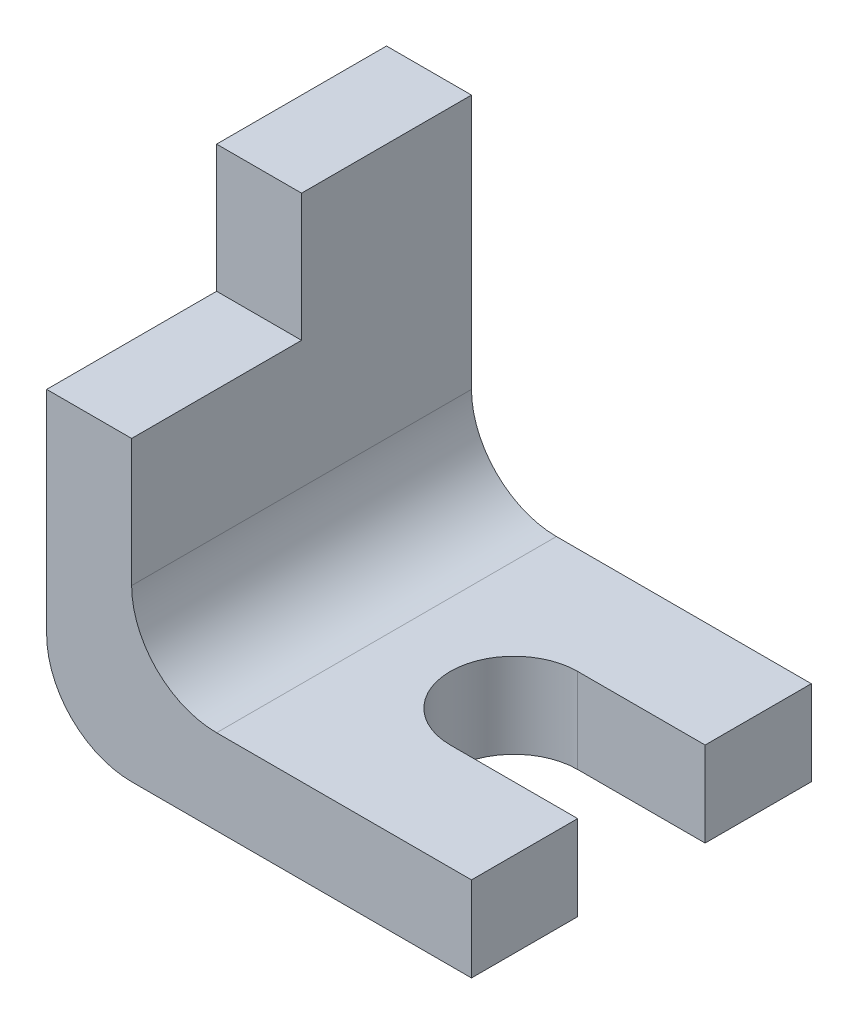
from build123d import *

# Parameters (mm, degrees)
BOSS_EXTRUDE2_DEPTH = 40
SKETCH4_W           = 20
SKETCH4_H           = 15
CUT_EXTRUDE1_DEPTH  = 10
SKETCH5_R           = 7.5
CUT_EXTRUDE2_DEPTH  = 13


with BuildPart() as part:
    # Sketch2 → Boss-Extrude2 (new body)
    with BuildSketch(Plane.XY):
        with BuildLine():
            Line((0, 10), (0, 50))
            Line((0, 50), (10, 50))
            Line((10, 50), (10, 20))
            ThreePointArc((10, 20), (12.928932188, 12.928932188), (20, 10))
            Line((20, 10), (50, 10))
            Line((50, 10), (50, 0))
            Line((50, 0), (10, 0))
            ThreePointArc((10, 0), (2.928932188, 2.928932188), (0, 10))
        make_face()
    extrude(amount=BOSS_EXTRUDE2_DEPTH)

    # Sketch4 → Cut-Extrude1 (cut)
    with BuildSketch(Plane(origin=(0, 0, 0), x_dir=(0, 0, -1), z_dir=(1, 0, 0))):
        with Locations((-30, 42.5)):
            Rectangle(SKETCH4_W, SKETCH4_H)
    extrude(amount=CUT_EXTRUDE1_DEPTH, mode=Mode.SUBTRACT)

    # Sketch5 → Cut-Extrude2 (cut)
    with BuildSketch(Plane(origin=(0, 0, 0), x_dir=(1, 0, 0), z_dir=(0, 1, 0))):
        with Locations((35, -20)):
            Circle(SKETCH5_R)
        Polygon((35, -20), (35, -12.5), (50, -12.5), (50, -27.5), (35, -27.5), align=None)
    extrude(amount=CUT_EXTRUDE2_DEPTH, mode=Mode.SUBTRACT)


solid = part.part
